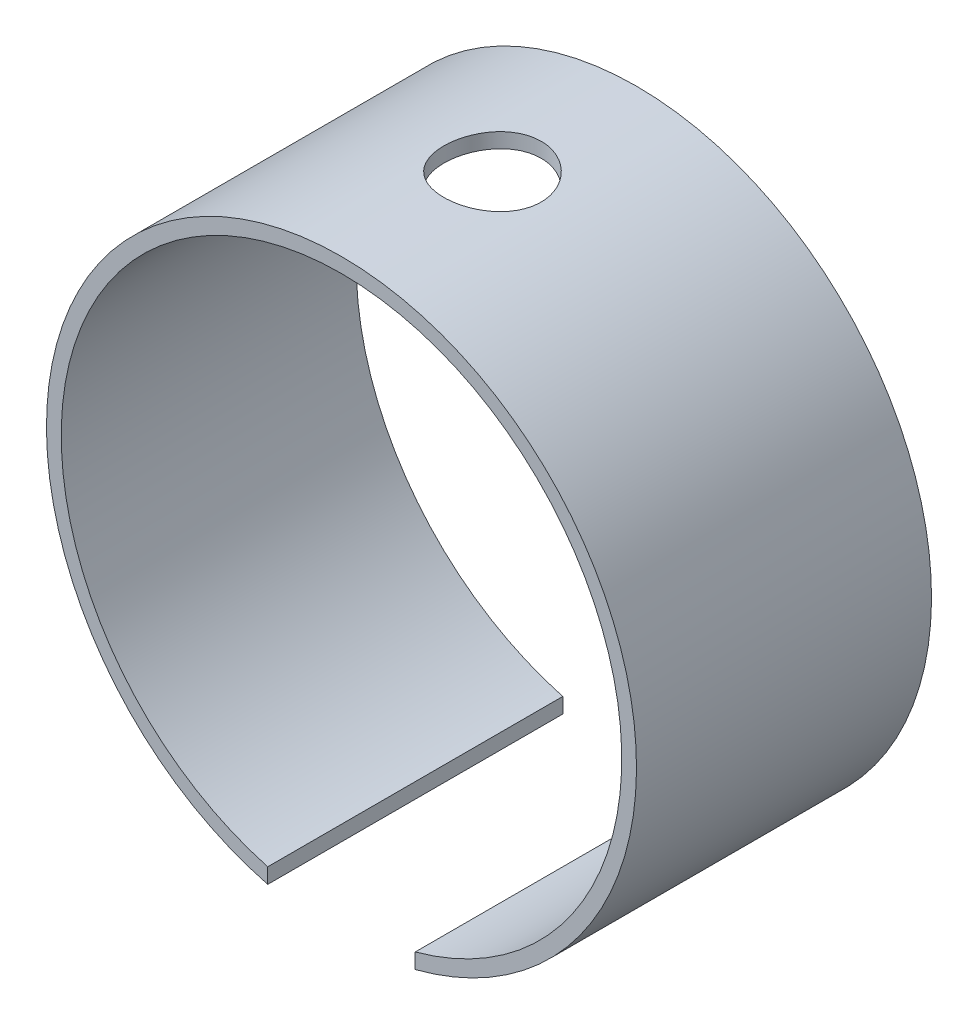
from build123d import *

# Parameters (mm, degrees)
SKETCH_1_R          = 10
SKETCH_1_R_2        = 9.5
EXTRUDE_1_DEPTH     = 10
SKETCH_2_R          = 1.65
CUT_EXTRUDE_1_DEPTH = 18.320508076
SKETCH_3_W          = 5
SKETCH_3_H          = 20.666812771
CUT_EXTRUDE_2_DEPTH = 18.320508249


with BuildPart() as part:
    # 草图1 → 凸台-拉伸1 (new body)
    with BuildSketch(Plane.XY):
        Circle(SKETCH_1_R)
        Circle(SKETCH_1_R_2, mode=Mode.SUBTRACT)
    extrude(amount=EXTRUDE_1_DEPTH)

    # 草图2 → 切除-拉伸1 (cut, through all)
    with BuildSketch(Plane(origin=(0, 0, 0), x_dir=(1, 0, 0), z_dir=(0, 1, 0))):
        with Locations(Location((0, -4.882407133, 0), (0, 0, 90))):
            Circle(SKETCH_2_R)
    extrude(amount=CUT_EXTRUDE_1_DEPTH, mode=Mode.SUBTRACT)

    # 草图3 → 切除-拉伸2 (cut, through all)
    with BuildSketch(Plane(origin=(0, 0, 0), x_dir=(1, 0, 0), z_dir=(0, 1, 0))):
        with Locations((0, -4.882407133)):
            Rectangle(SKETCH_3_W, SKETCH_3_H)
    extrude(amount=-CUT_EXTRUDE_2_DEPTH, mode=Mode.SUBTRACT)


solid = part.part
